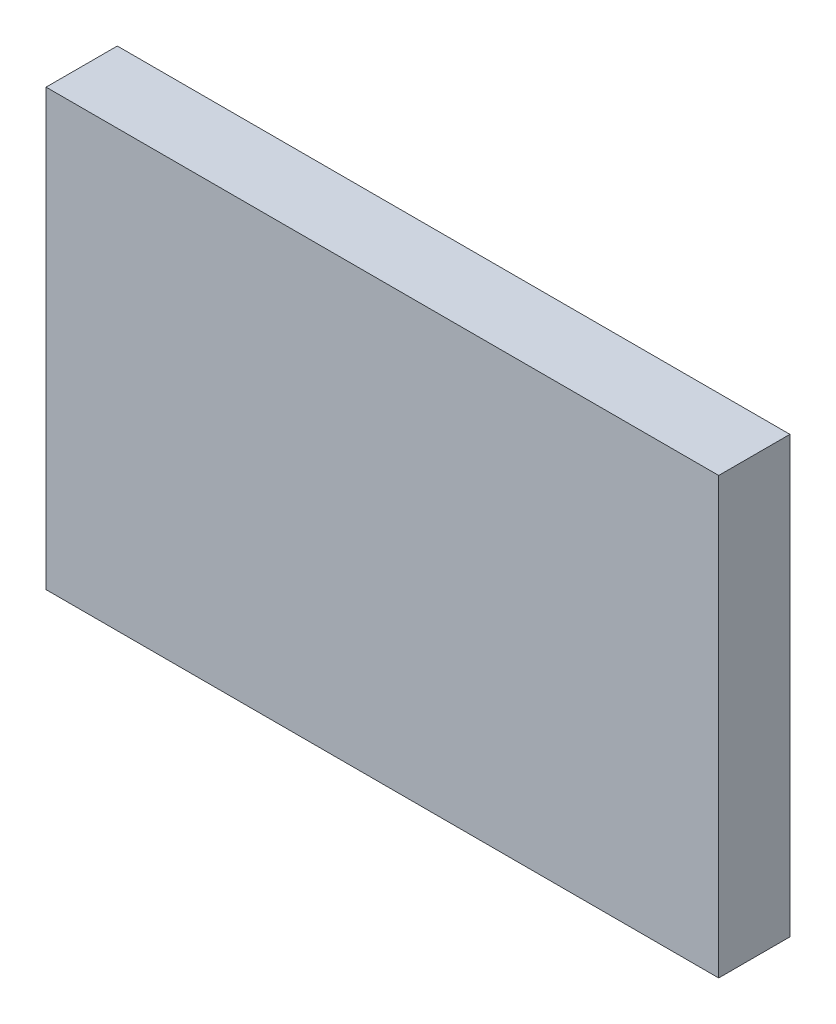
from build123d import *

# Parameters (mm, degrees)
ESQUISSE1_W        = 85
ESQUISSE1_H        = 55
BOSS_EXTRU_1_DEPTH = 9


with BuildPart() as part:
    # Esquisse1 → Boss.-Extru.1 (new body)
    with BuildSketch(Plane.XY):
        Rectangle(ESQUISSE1_W, ESQUISSE1_H)
    extrude(amount=BOSS_EXTRU_1_DEPTH)


solid = part.part
